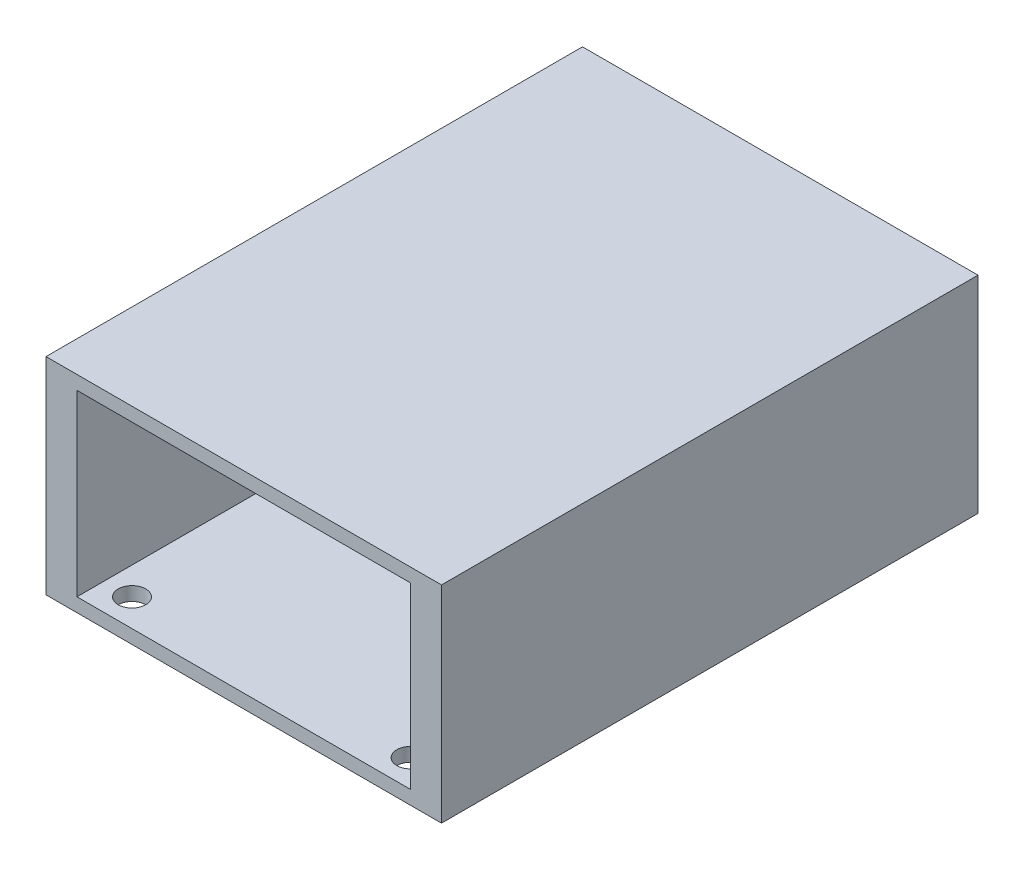
from build123d import *

# Parameters (mm, degrees)
SKETCH1_W           = 57.5
SKETCH1_H           = 78
BOSS_EXTRUDE1_DEPTH = 30
SKETCH2_W           = 48.5
SKETCH2_H           = 26
CUT_EXTRUDE1_DEPTH  = 76
SKETCH3_R           = 2
SKETCH3_R_2         = 1
CUT_EXTRUDE2_DEPTH  = 60.424849114


with BuildPart() as part:
    # Sketch1 → Boss-Extrude1 (new body)
    with BuildSketch(Plane(origin=(0, 0, 0), x_dir=(1, 0, 0), z_dir=(0, 1, 0))):
        with Locations((-4.848039216, 1.230392157)):
            Rectangle(SKETCH1_W, SKETCH1_H)
    extrude(amount=BOSS_EXTRUDE1_DEPTH)

    # Sketch2 → Cut-Extrude1 (cut)
    with BuildSketch(Plane.XY.offset(37.769607843)):
        with Locations((-4.848039216, 15)):
            Rectangle(SKETCH2_W, SKETCH2_H)
    extrude(amount=-CUT_EXTRUDE1_DEPTH, mode=Mode.SUBTRACT)

    # Sketch3 → Cut-Extrude2 (cut, through all)
    with BuildSketch(Plane(origin=(0, 2, 0), x_dir=(1, 0, 0), z_dir=(0, 1, 0))):
        with Locations(Location((15.401960784, -33.769607843, 0), (0, 0, 270))):
            Circle(SKETCH3_R)
        with Locations(Location((-25.098039216, 34.230392157, 0), (0, 0, 270))):
            Circle(SKETCH3_R_2)
        with Locations(Location((-25.098039216, -33.769607843, 0), (0, 0, 270))):
            Circle(SKETCH3_R)
    extrude(amount=-CUT_EXTRUDE2_DEPTH, mode=Mode.SUBTRACT)


solid = part.part
